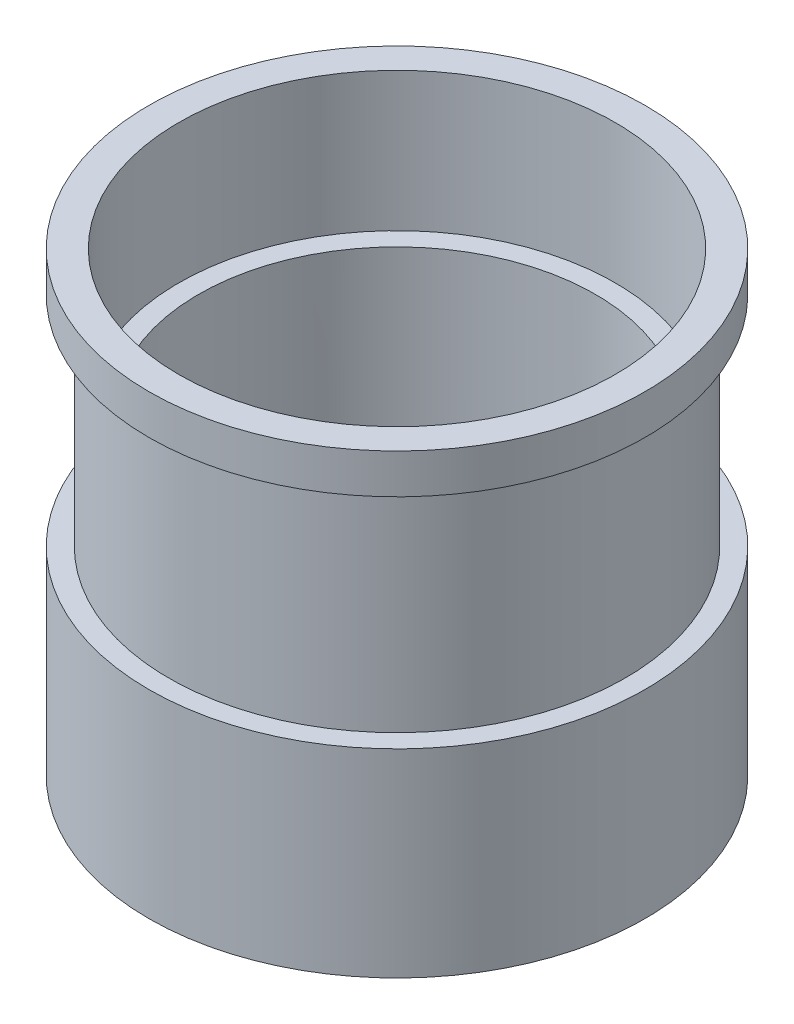
from build123d import *

# Parameters (mm, degrees)
CROQUIS1_R                 = 12.5
SALIENTE_EXTRUIR1_DEPTH    = 11.5
CROQUIS2_R                 = 11
CORTAR_EXTRUIR1_DEPTH      = 7
CORTAR_EXTRUIR2_DEPTH      = 22.089096709
CORTAR_EXTRUIR2_DEPTH_BACK = 22.089096709
CROQUIS3_R                 = 10
CROQUIS4_W                 = 1
CROQUIS4_H                 = 11


with BuildPart() as part:
    # Croquis1 → Saliente-Extruir1 (new, symmetric)
    with BuildSketch(Plane(origin=(0, 0, 0), x_dir=(1, 0, 0), z_dir=(0, 1, 0))):
        with Locations(Location((0, 0, 0), (0, 0, 270))):
            Circle(CROQUIS1_R)
    extrude(amount=SALIENTE_EXTRUIR1_DEPTH, both=True)

    # Croquis2 → Cortar-Extruir1 (cut)
    with BuildSketch(Plane(origin=(0, 11.5, 0), x_dir=(1, 0, 0), z_dir=(0, 1, 0))):
        with Locations(Location((0, 0, 0), (0, 0, 270))):
            Circle(CROQUIS2_R)
    cortar_extruir1 = extrude(amount=-CORTAR_EXTRUIR1_DEPTH, mode=Mode.SUBTRACT)

    # Croquis3 → Cortar-Extruir2 (cut, two sides: drawn at the far end of the back side and taken through both)
    with BuildSketch(Plane(origin=(0, 0, 0), x_dir=(1, 0, 0), z_dir=(0, 1, 0)).offset(-CORTAR_EXTRUIR2_DEPTH_BACK)):
        with Locations(Location((0, 0, 0), (0, 0, 270))):
            Circle(CROQUIS3_R)
    extrude(amount=CORTAR_EXTRUIR2_DEPTH + CORTAR_EXTRUIR2_DEPTH_BACK, mode=Mode.SUBTRACT)

    # Simetría1: Cortar-Extruir1 across plane
    add(cortar_extruir1.mirror(Plane.ZX), mode=Mode.SUBTRACT)

    # Croquis4 → Cortar-Revolución1 (revolve, cut)
    with BuildSketch(Plane.XY, mode=Mode.PRIVATE) as cortar_revoluci_n1_sk:
        with Locations((12, 4)):
            Rectangle(CROQUIS4_W, CROQUIS4_H)
    revolve(cortar_revoluci_n1_sk.sketch.rotate(Axis((0, -12.65, 0), (0, 1, 0)), 90), axis=Axis((0, -12.65, 0), (0, 1, 0)), mode=Mode.SUBTRACT)


solid = part.part
